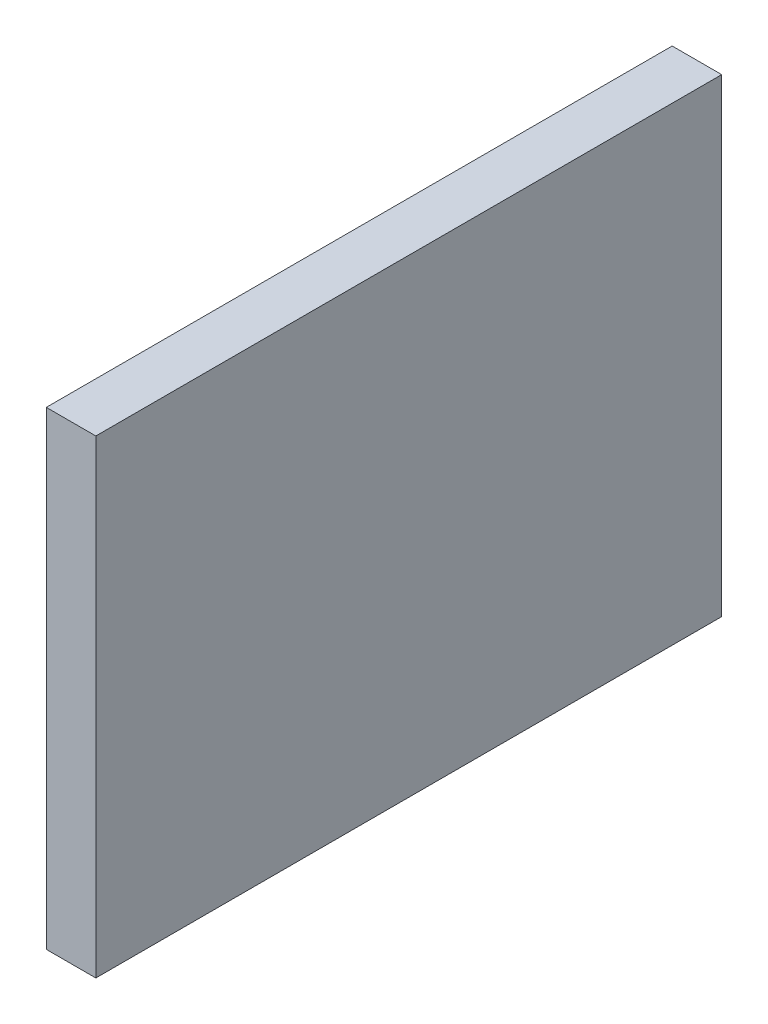
from build123d import *

# Parameters (mm, degrees)
SKETCH1_W           = 120
SKETCH1_H           = 90
BOSS_EXTRUDE1_DEPTH = 9.5


with BuildPart() as part:
    # Sketch1 → Boss-Extrude1 (new body)
    with BuildSketch(Plane(origin=(0, 0, 0), x_dir=(0, 0, -1), z_dir=(1, 0, 0))):
        Rectangle(SKETCH1_W, SKETCH1_H)
    extrude(amount=BOSS_EXTRUDE1_DEPTH)


solid = part.part
